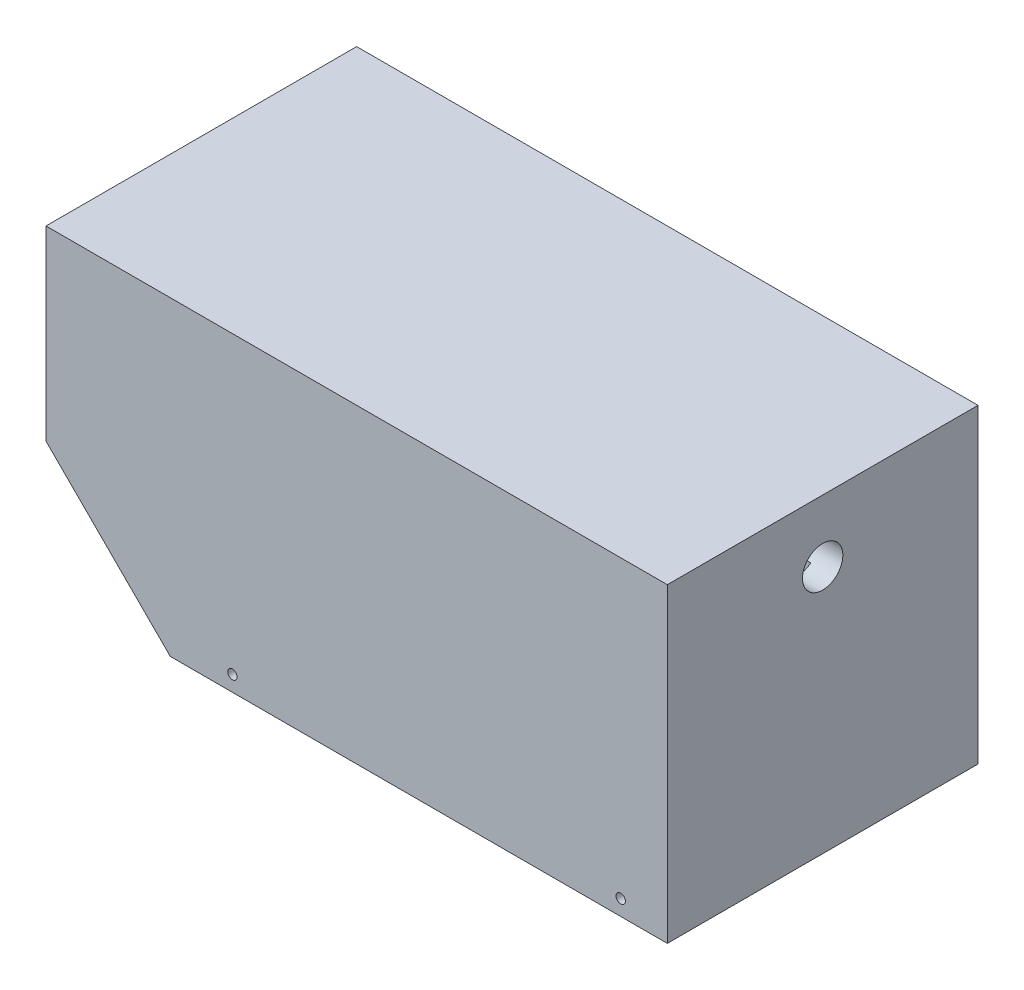
from build123d import *

# Parameters (mm, degrees)
ESQUISSE1_W             = 200
ESQUISSE1_H             = 100
BOSS_EXTRU_1_DEPTH      = 100
CHANFREIN1_SIZE         = 40
ESQUISSE2_R             = 6.5
ENL_V_MAT_EXTRU_1_DEPTH = 230.128784748
ESQUISSE4_R             = 1.5
ENL_V_MAT_EXTRU_3_DEPTH = 151
ESQUISSE5_W             = 144
ESQUISSE5_H             = 84
ENL_V_MAT_EXTRU_4_DEPTH = 75
ESQUISSE6_W             = 152
ESQUISSE6_H             = 92
ENL_V_MAT_EXTRU_5_DEPTH = 8


with BuildPart() as part:
    # Esquisse1 → Boss.-Extru.1 (new body)
    with BuildSketch(Plane.XY):
        Rectangle(ESQUISSE1_W, ESQUISSE1_H)
    extrude(amount=BOSS_EXTRU_1_DEPTH)

    # Chanfrein1
    chanfrein1_edges = [part.edges().sort_by_distance(p)[0] for p in [
        (-100, -50, 50),
    ]]
    chamfer(chanfrein1_edges, length=CHANFREIN1_SIZE)

    # Esquisse2 → Enlèv. mat.-Extru.1 (cut, through all)
    with BuildSketch(Plane(origin=(100, 0, 0), x_dir=(0, 0, -1), z_dir=(1, 0, 0))):
        with Locations((-50, 30)):
            Circle(ESQUISSE2_R)
    extrude(amount=-ENL_V_MAT_EXTRU_1_DEPTH, mode=Mode.SUBTRACT)

    # Esquisse4 → Enlèv. mat.-Extru.3 (cut, through all)
    with BuildSketch(Plane.XY.offset(100)):
        with Locations((85, -45)):
            Circle(ESQUISSE4_R)
        with Locations((-40, -45)):
            Circle(ESQUISSE4_R)
    extrude(amount=-ENL_V_MAT_EXTRU_3_DEPTH, mode=Mode.SUBTRACT)

    # Esquisse5 → Enlèv. mat.-Extru.4 (cut)
    with BuildSketch(Plane.XZ.offset(50)):
        with Locations((20, 50)):
            Rectangle(ESQUISSE5_W, ESQUISSE5_H)
    extrude(amount=-ENL_V_MAT_EXTRU_4_DEPTH, mode=Mode.SUBTRACT)

    # Esquisse6 → Enlèv. mat.-Extru.5 (cut)
    with BuildSketch(Plane.XZ.offset(50)):
        with Locations((20, 50)):
            Rectangle(ESQUISSE6_W, ESQUISSE6_H)
    extrude(amount=-ENL_V_MAT_EXTRU_5_DEPTH, mode=Mode.SUBTRACT)


solid = part.part
